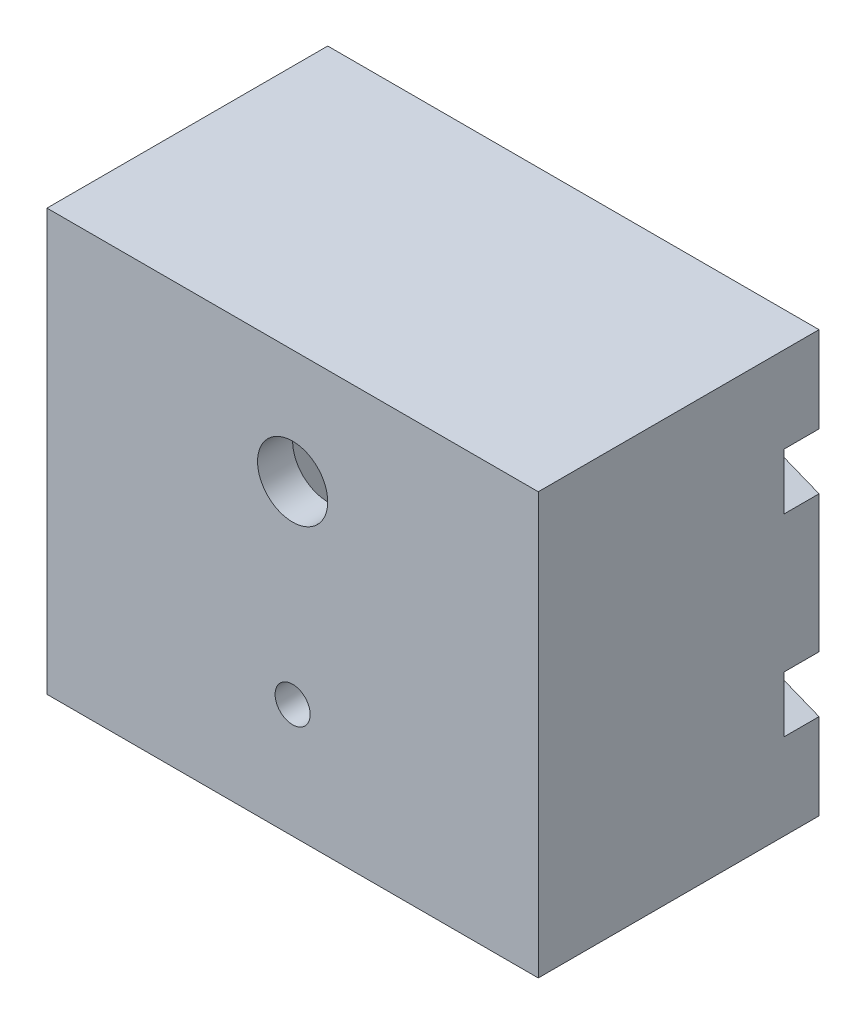
from build123d import *

# Parameters (mm, degrees)
SKETCH1_W           = 44.45
SKETCH1_H           = 38.1
BOSS_EXTRUDE1_DEPTH = 25.4
SKETCH2_W           = 38.1
SKETCH2_H           = 31.75
CUT_EXTRUDE1_DEPTH  = 22.225
SKETCH3_R           = 3.175
SKETCH3_R_2         = 1.5875
CUT_EXTRUDE2_DEPTH  = 22.225
CUT_EXTRUDE3_DEPTH  = 3.175


with BuildPart() as part:
    # Sketch1 → Boss-Extrude1 (new body)
    with BuildSketch(Plane.XY):
        with Locations((22.225, 19.05)):
            Rectangle(SKETCH1_W, SKETCH1_H)
    extrude(amount=BOSS_EXTRUDE1_DEPTH)

    # Sketch2 → Cut-Extrude1 (cut)
    with BuildSketch(Plane(origin=(0, 0, 0), x_dir=(-1, 0, 0), z_dir=(0, 0, -1))):
        with Locations((-22.225, 19.05)):
            Rectangle(SKETCH2_W, SKETCH2_H)
    extrude(amount=-CUT_EXTRUDE1_DEPTH, mode=Mode.SUBTRACT)

    # Sketch3 → Cut-Extrude2 (cut)
    with BuildSketch(Plane.XY.offset(25.4)):
        with Locations((22.225, 27.78125)):
            Circle(SKETCH3_R)
        with Locations((22.225, 10.31875)):
            Circle(SKETCH3_R_2)
    extrude(amount=-CUT_EXTRUDE2_DEPTH, mode=Mode.SUBTRACT)

    # Sketch4 → Cut-Extrude3 (cut)
    with BuildSketch(Plane(origin=(0, 0, 0), x_dir=(-1, 0, 0), z_dir=(0, 0, -1))):
        Polygon((-41.275, 26.51125), (-41.275, 29.05125), (-44.45, 30.32125), (-44.45, 25.24125), align=None)
        Polygon((-44.45, 12.85875), (-41.275, 11.58875), (-41.275, 9.04875), (-44.45, 7.77875), align=None)
        Polygon((0, 25.24125), (-3.175, 26.51125), (-3.175, 29.05125), (0, 30.32125), align=None)
        Polygon((0, 12.85875), (0, 7.77875), (-3.175, 9.04875), (-3.175, 11.58875), align=None)
    extrude(amount=-CUT_EXTRUDE3_DEPTH, mode=Mode.SUBTRACT)


solid = part.part
